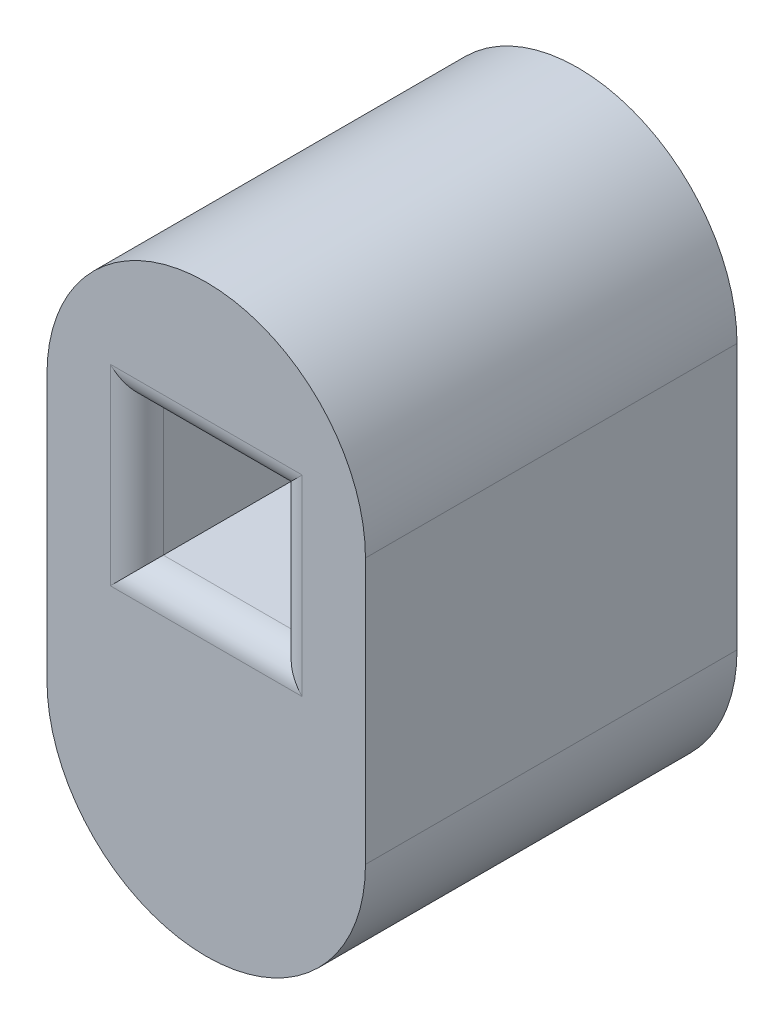
from build123d import *

# Parameters (mm, degrees)
SKETCH1_W           = 5.23
SKETCH1_H           = 5.23
BOSS_EXTRUDE1_DEPTH = 14
FILLET1_R           = 1
FILLET2_R           = 1


with BuildPart() as part:
    # Sketch1 → Boss-Extrude1 (new body)
    with BuildSketch(Plane.XY):
        with BuildLine():
            Line((-6, 0), (-6, 10))
            ThreePointArc((-6, 10), (0, 16), (6, 10))
            Line((6, 10), (6, 0))
            ThreePointArc((6, 0), (0, -6), (-6, 0))
        make_face()
        with Locations((0, 7.9)):
            Rectangle(SKETCH1_W, SKETCH1_H, mode=Mode.SUBTRACT)
    extrude(amount=BOSS_EXTRUDE1_DEPTH)

    # Fillet1
    fillet1_edges = [part.edges().sort_by_distance(p)[0] for p in [
        (2.615, 7.9, 14),
        (0, 10.515, 14),
        (-2.615, 7.9, 14),
        (0, 5.285, 14),
    ]]
    fillet(fillet1_edges, radius=FILLET1_R)

    # Fillet2
    fillet2_edges = [part.edges().sort_by_distance(p)[0] for p in [
        (2.615, 7.9, 0),
        (0, 10.515, 0),
        (-2.615, 7.9, 0),
        (0, 5.285, 0),
    ]]
    fillet(fillet2_edges, radius=FILLET2_R)


solid = part.part
